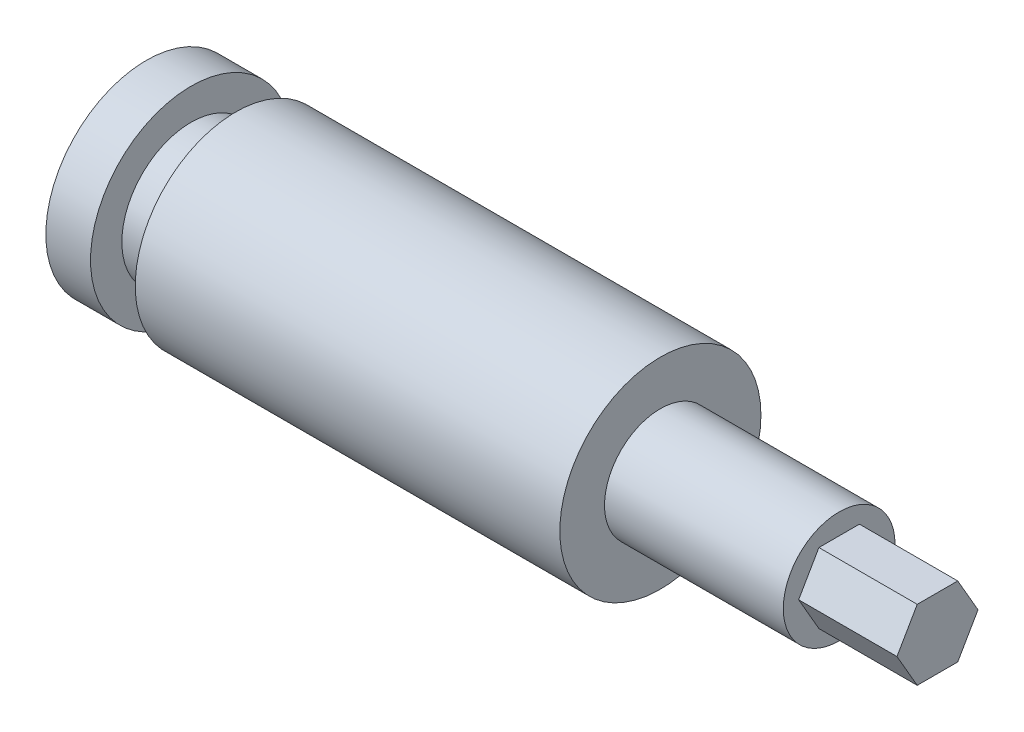
from build123d import *

# Parameters (mm, degrees)
SKETCH_2_W                  = 4.4
SKETCH_2_H                  = 0.93
CUT_EXTRUDE_1_DEPTH         = 36.967485317
PATTERN_CIRCULAR_1_COUNT    = 6
HOLE_WIZARD_M31_D           = 2.5
HOLE_WIZARD_M31_DEPTH       = 8.5
HOLE_WIZARD_M31_CSINK_D     = 3.2
HOLE_WIZARD_M31_CSINK_ANGLE = 90
HOLE_WIZARD_M31_TIP         = 0.751075774


with BuildPart() as part:
    # Эскиз1 → Повернуть1 (revolve)
    with BuildSketch(Plane.XY):
        Polygon((0, 0), (0, 4.5), (2, 4.5), (2, 3.1), (4, 3.1), (4, 4.5), (23, 4.5), (23, 2.5), (35.4, 2.5), (35.4, 0), align=None)
    revolve(axis=Axis((0, 0, 0), (-1, 0, 0)))

    # Эскиз2 → Вырез-Вытянуть1 (cut, symmetric)
    with BuildSketch(Plane.XY):
        with Locations((33.2, 2.035)):
            Rectangle(SKETCH_2_W, SKETCH_2_H)
    cut_extrude_1 = extrude(amount=CUT_EXTRUDE_1_DEPTH, both=True, mode=Mode.SUBTRACT)

    # Круговой массив1: Вырез-Вытянуть1 ×6 about axis
    pattern_circular_1_axis = Axis((0, 0, 0), (1, 0, 0))
    for i in range(1, PATTERN_CIRCULAR_1_COUNT):
        add(cut_extrude_1.rotate(pattern_circular_1_axis, i * 360 / PATTERN_CIRCULAR_1_COUNT), mode=Mode.SUBTRACT)

    # Отверстие обработанное метчиком M31
    with Locations(Plane.ZY):
        with Locations((0, 0)):
            CounterSinkHole(HOLE_WIZARD_M31_D / 2, HOLE_WIZARD_M31_CSINK_D / 2, depth=HOLE_WIZARD_M31_DEPTH, counter_sink_angle=HOLE_WIZARD_M31_CSINK_ANGLE)
            with Locations((0, 0, -(HOLE_WIZARD_M31_DEPTH + HOLE_WIZARD_M31_TIP / 2))):  # 118° drill point
                Cone(0, HOLE_WIZARD_M31_D / 2, HOLE_WIZARD_M31_TIP, mode=Mode.SUBTRACT)


solid = part.part
